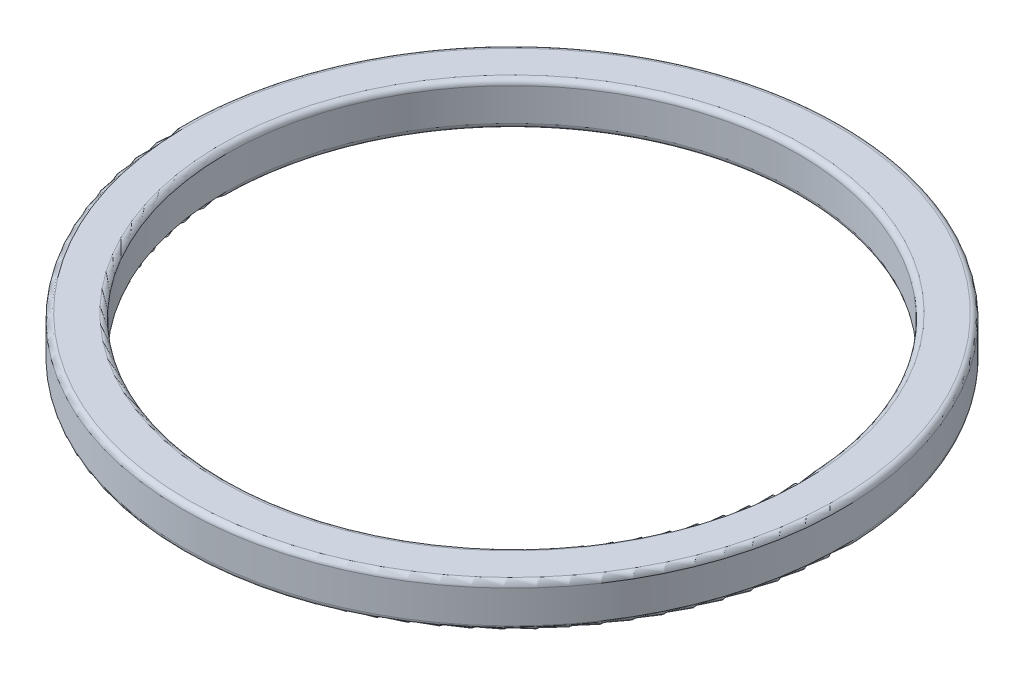
from build123d import *

# Parameters (mm, degrees)
SKETCH1_R           = 12.1
SKETCH1_R_2         = 10.5
EXTRUDE_THIN1_DEPTH = 1.6
FILLET1_R           = 0.2


with BuildPart() as part:
    # Sketch1 → Extrude-Thin1 (new body)
    with BuildSketch(Plane(origin=(0, 0, 0), x_dir=(1, 0, 0), z_dir=(0, 1, 0))):
        Circle(SKETCH1_R)
        Circle(SKETCH1_R_2, mode=Mode.SUBTRACT)
    extrude(amount=EXTRUDE_THIN1_DEPTH)

    # Fillet1
    fillet1_edges = [part.edges().sort_by_distance(p)[0] for p in [
        (-12.1, 0, 0),
        (-10.5, 0, 0),
        (-12.1, 1.6, 0),
        (-10.5, 1.6, 0),
    ]]
    fillet(fillet1_edges, radius=FILLET1_R)


solid = part.part
